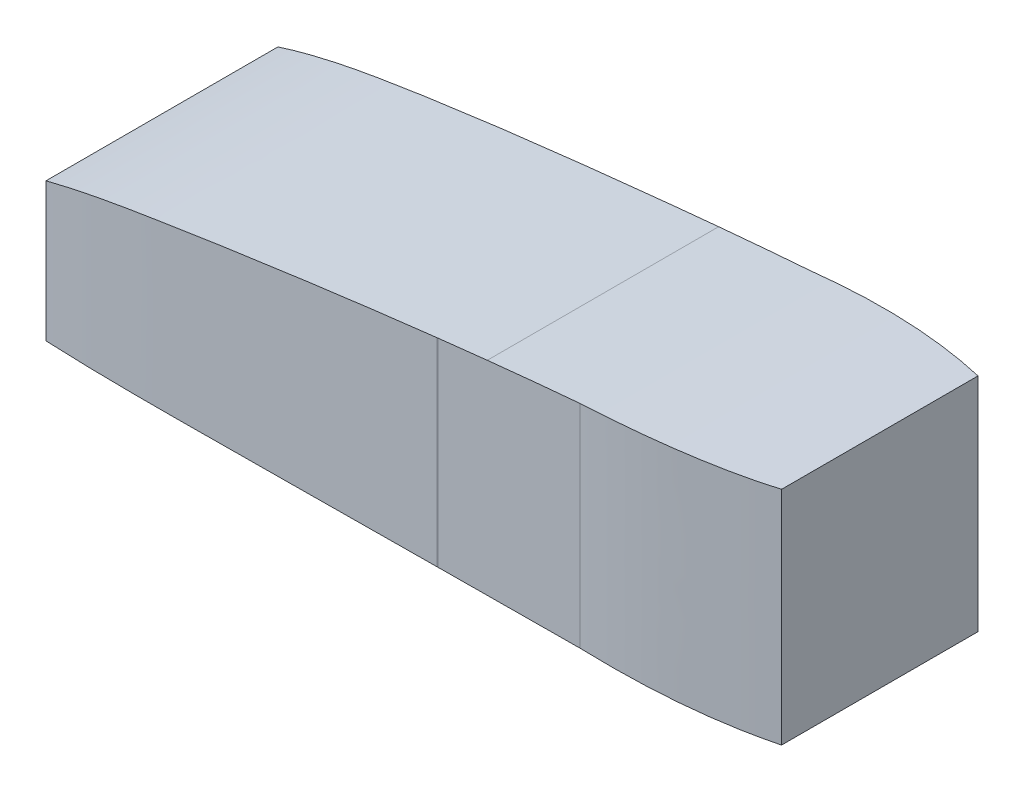
from build123d import *

# Parameters (mm, degrees)
BOSS_EXTRUDE1_DEPTH     = 750
CUT_EXTRUDE1_DEPTH      = 1273.484372332
CUT_EXTRUDE1_DEPTH_BACK = 1273.484372332


with BuildPart() as part:
    # Sketch1 → Boss-Extrude1 (new body)
    with BuildSketch(Plane(origin=(0, 0, 0), x_dir=(1, 0, 0), z_dir=(0, 1, 0))):
        with BuildLine():
            Line((-824.070267574, 319.888300477), (-824.0773511, 319.88819474))
            add(Edge.make_bspline(
                [(-824.0773511, 319.88819474), (-874.868887333, 319.129990608), (-925.648663082, 317.812733824), (-976.406262979, 315.441313757)],
                knots=[0, 0, 0, 0, 1, 1, 1, 1], degree=3))
            Line((-976.406262979, 315.441313757), (-976.406262979, -315.441313757))
            add(Edge.make_bspline(
                [(-976.406262979, -315.441313757), (-799.073697369, -323.726378565), (-621.509004257, -321.162775901), (-266.790583353, -318.716221256), (-89.57617612, -317.059567038), (87.640172462, -315.689242558)],
                knots=[0, 0, 0, 0, 0.5, 0.5, 0.999199508, 0.999199508, 0.999199508, 0.999199508], degree=3))
            Line((87.640172462, -315.689242558), (89.637542637, -315.673810137))
            add(Edge.make_bspline(
                [(89.637542637, -315.673810137), (217.765504689, -314.684458138), (345.894162181, -313.787538663), (474.023665878, -313.003090638)],
                knots=[0.002969541, 0.002969541, 0.002969541, 0.002969541, 1, 1, 1, 1], degree=3))
            add(Edge.make_bspline(
                [(474.023665878, -313.003090638), (686.669169684, -319.641146109), (849.408822497, -299.87907185), (976.406262979, -267.239829046)],
                knots=[0.571508356, 0.571508356, 0.571508356, 0.571508356, 1, 1, 1, 1], degree=3))
            Line((976.406262979, -267.239829046), (976.406262979, 267.239829046))
            add(Edge.make_bspline(
                [(976.406262979, 267.239829046), (849.408822469, 299.87907185), (686.669169656, 319.641146109), (474.02366585, 313.003090638)],
                knots=[0.571508356, 0.571508356, 0.571508356, 0.571508356, 1, 1, 1, 1], degree=3))
            add(Edge.make_bspline(
                [(474.02366585, 313.003090638), (345.691246826, 313.788780972), (217.359676832, 314.687299274), (89.028804359, 315.678511261)],
                knots=[0, 0, 0, 0, 0.998609429, 0.998609429, 0.998609429, 0.998609429], degree=3))
            Line((89.028804359, 315.678511261), (85.891753587, 315.702849086))
            add(Edge.make_bspline(
                [(85.891753587, 315.702849086), (-217.43435092, 318.069601423), (-520.834315227, 324.414625782), (-824.070267574, 319.888300477)],
                knots=[0.002850106, 0.002850106, 0.002850106, 0.002850106, 1, 1, 1, 1], degree=3))
        make_face()
    extrude(amount=BOSS_EXTRUDE1_DEPTH)

    # Sketch2 → Cut-Extrude1 (cut, two sides: drawn at the far end of the back side and taken through both)
    with BuildSketch(Plane.XY.offset(-CUT_EXTRUDE1_DEPTH_BACK)):
        with BuildLine():
            add(Edge.make_bspline(
                [(976.406262981, 602.627781841), (862.889105388, 599.111372984), (646.897637385, 592.182424007), (369.77964804, 568.541427312), (223.393737036, 553.889357901)],
                knots=[0.03363534, 0.03363534, 0.03363534, 0.03363534, 0.070138481, 0.108742005, 0.108742005, 0.108742005, 0.108742005], degree=3))
            add(Edge.make_bspline(
                [(223.393737036, 553.889357901), (-83.341325087, 523.179574554), (-513.704400905, 467.82032303), (-830.443260508, 415.239060597), (-933.333955906, 389.730975253), (-976.406262981, 377.260704577)],
                knots=[0.108777165, 0.108777165, 0.108777165, 0.108777165, 0.189662497, 0.216203451, 0.238160454, 0.238160454, 0.238160454, 0.238160454], degree=3))
            Line((-976.406262981, 377.260704577), (-976.406262981, 825.627981008))
            Line((-976.406262981, 825.627981008), (976.406262981, 825.627981008))
            Line((976.406262981, 825.627981008), (976.406262981, 602.627781841))
        make_face()
    extrude(amount=CUT_EXTRUDE1_DEPTH + CUT_EXTRUDE1_DEPTH_BACK, mode=Mode.SUBTRACT)


solid = part.part
